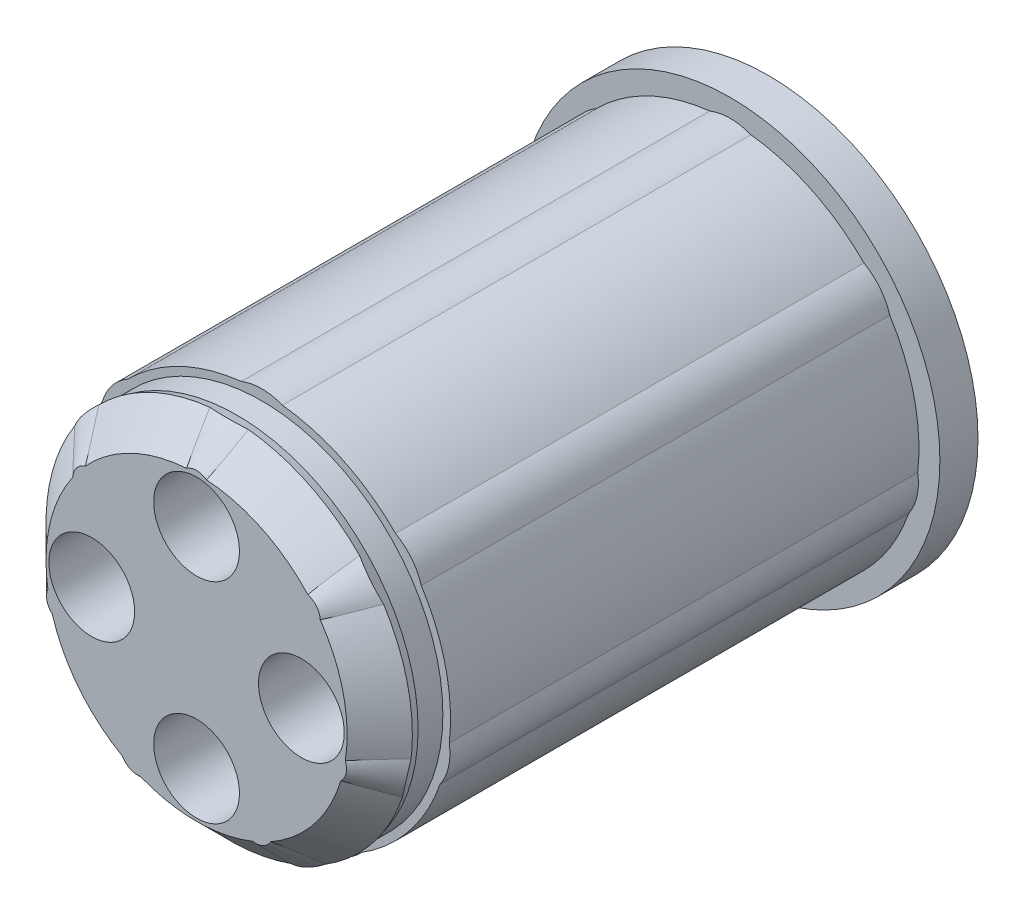
from build123d import *

# Parameters (mm, degrees)
AUFSATZ_LINEAR_AUSTRAGEN1_DEPTH      = 30
SKIZZE2_R                            = 11
AUFSATZ_LINEAR_AUSTRAGEN2_DEPTH      = 2
FASE1_SIZE                           = 2
SCHNITT_LINEAR_AUSTRAGEN1_DEPTH      = 33.031234844
SCHNITT_LINEAR_AUSTRAGEN1_DEPTH_BACK = 33.031234844
SKIZZE3_R                            = 2.25


with BuildPart() as part:
    # Skizze1 → Aufsatz-Linear austragen1 (new body)
    with BuildSketch(Plane.XY):
        with BuildLine():
            ThreePointArc((9.834694469, -1.13524654), (9.651786331, 2.202957246), (8.368188528, 5.289935799))
            ThreePointArc((8.368188528, 5.289935799), (7.857406399, 6.266072509), (7.019403191, 6.981259116))
            ThreePointArc((7.019403191, 6.981259116), (4.295449017, 8.919591792), (1.081641859, 9.840734266))
            ThreePointArc((1.081641859, 9.840734266), (0, 10.05), (-1.081641859, 9.840734266))
            ThreePointArc((-1.081641859, 9.840734266), (-4.295449017, 8.919591792), (-7.019403191, 6.981259116))
            ThreePointArc((-7.019403191, 6.981259116), (-7.857406399, 6.266072509), (-8.368188528, 5.289935799))
            ThreePointArc((-8.368188528, 5.289935799), (-9.651786331, 2.202957246), (-9.834694469, -1.13524654))
            ThreePointArc((-9.834694469, -1.13524654), (-9.798025517, -2.236335386), (-9.353318555, -3.244292219))
            ThreePointArc((-9.353318555, -3.244292219), (-7.740131676, -6.172549038), (-5.24426022, -8.396888397))
            ThreePointArc((-5.24426022, -8.396888397), (-4.360531578, -9.054737122), (-3.295208938, -9.335502025))
            ThreePointArc((-3.295208938, -9.335502025), (0, -9.9), (3.295208938, -9.335502025))
            ThreePointArc((3.295208938, -9.335502025), (4.360531578, -9.054737122), (5.24426022, -8.396888397))
            ThreePointArc((5.24426022, -8.396888397), (7.740131676, -6.172549038), (9.353318555, -3.244292219))
            ThreePointArc((9.353318555, -3.244292219), (9.798025517, -2.236335386), (9.834694469, -1.13524654))
        make_face()
    extrude(amount=AUFSATZ_LINEAR_AUSTRAGEN1_DEPTH)

    # Skizze2 → Aufsatz-Linear austragen2 (add)
    with BuildSketch(Plane.XY):
        Circle(SKIZZE2_R)
    extrude(amount=AUFSATZ_LINEAR_AUSTRAGEN2_DEPTH)

    # Fase1
    fase1_edges = [part.edges().sort_by_distance(p)[0] for p in [
        (9.798025517, -2.236335386, 30),
        (7.740131676, -6.172549038, 30),
        (4.360531578, -9.054737122, 30),
        (0, -9.9, 30),
        (-4.360531578, -9.054737122, 30),
        (-7.740131676, -6.172549038, 30),
        (-9.798025517, -2.236335386, 30),
        (-9.651786331, 2.202957246, 30),
        (-7.857406399, 6.266072509, 30),
        (-4.295449017, 8.919591792, 30),
        (0, 10.05, 30),
        (4.295449017, 8.919591792, 30),
        (7.857406399, 6.266072509, 30),
        (9.651786331, 2.202957246, 30),
    ]]
    chamfer(fase1_edges, length=FASE1_SIZE)

    # Skizze3 → Schnitt-Linear austragen1 (cut, two sides: drawn at the far end of the back side and taken through both)
    with BuildSketch(Plane.XY.offset(2).offset(-SCHNITT_LINEAR_AUSTRAGEN1_DEPTH_BACK)):
        with Locations((0, 5.5)):
            Circle(SKIZZE3_R)
        with Locations((5.5, 0)):
            Circle(SKIZZE3_R)
        with Locations((0, -5.5)):
            Circle(SKIZZE3_R)
        with Locations((-5.5, 0)):
            Circle(SKIZZE3_R)
    extrude(amount=SCHNITT_LINEAR_AUSTRAGEN1_DEPTH + SCHNITT_LINEAR_AUSTRAGEN1_DEPTH_BACK, mode=Mode.SUBTRACT)

    # Skizze4 → Schnitt-Rotation1 (revolve, cut)
    with BuildSketch(Plane(origin=(0, 0, 0), x_dir=(0, 0, -1), z_dir=(1, 0, 0))):
        Polygon((-27.876581368, 10.05), (-26.576581368, 10.05), (-26.576581368, 9.5), (-27.876581368, 9.5), (-29.929209312, 10.05), align=None)
    revolve(axis=Axis((0, 0, 0), (0, 0, -1)), mode=Mode.SUBTRACT)


solid = part.part
